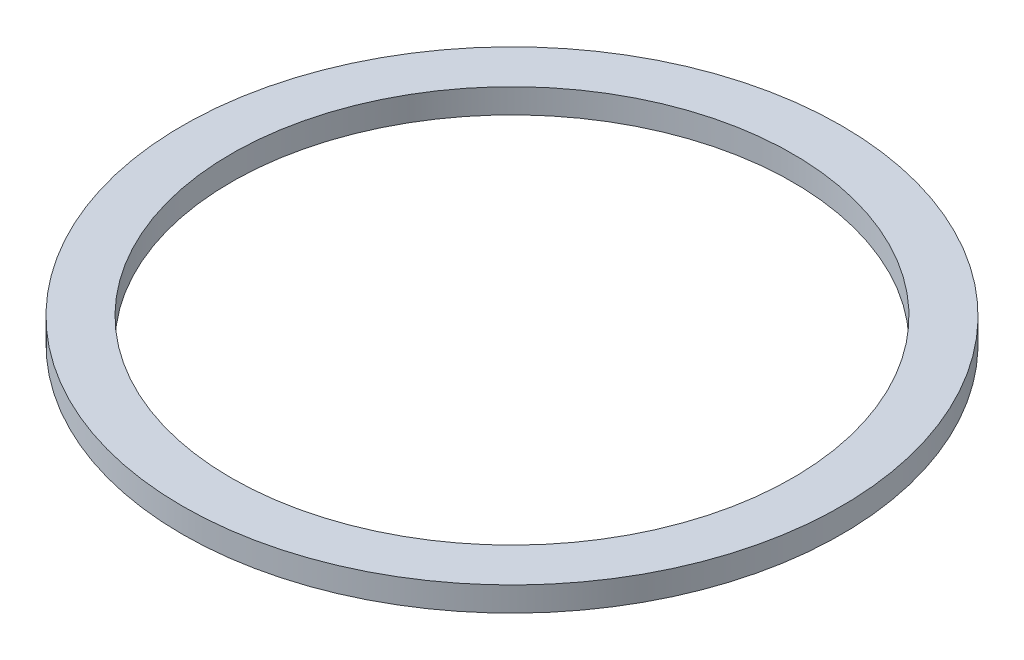
from build123d import *

# Parameters (mm, degrees)
SKETCH1_R           = 13.5
SKETCH1_R_2         = 11.5
BOSS_EXTRUDE1_DEPTH = 1


with BuildPart() as part:
    # Sketch1 → Boss-Extrude1 (new body)
    with BuildSketch(Plane(origin=(0, 0, 0), x_dir=(1, 0, 0), z_dir=(0, 1, 0))):
        with Locations(Location((0, 0, 0), (0, 0, 270))):
            Circle(SKETCH1_R)
        with Locations(Location((0, 0, 0), (0, 0, 270))):
            Circle(SKETCH1_R_2, mode=Mode.SUBTRACT)
    extrude(amount=BOSS_EXTRUDE1_DEPTH)


solid = part.part
